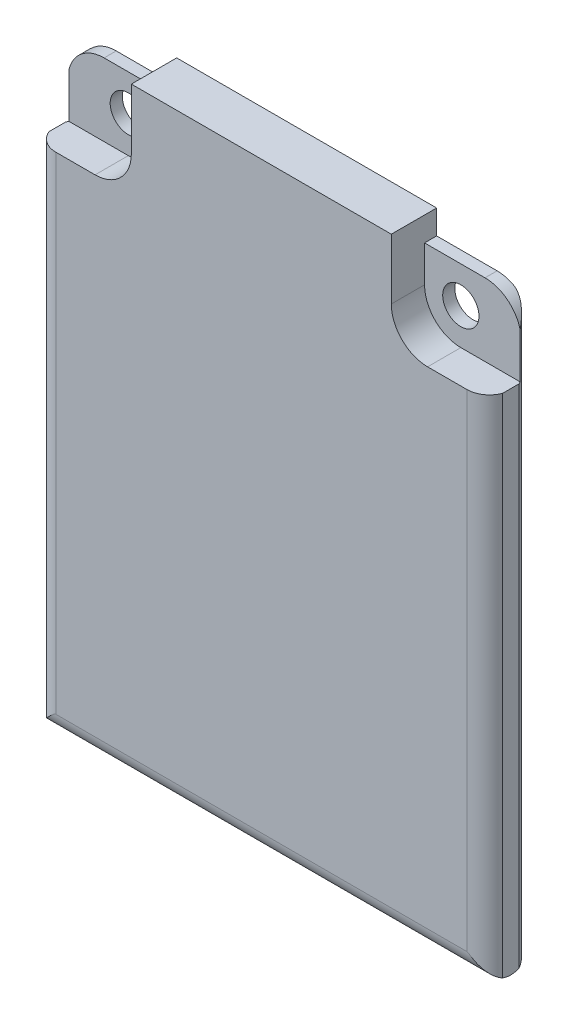
from build123d import *

# Parameters (mm, degrees)
RESSALTO_EXTRUS_O1_DEPTH = 3.75
ESBO_O1_3_R              = 1.5
RESSALTO_EXTRUS_O2_DEPTH = 1
CORTE_EXTRUS_O1_DEPTH    = 46.225131288
CORTE_EXTRUS_O2_DEPTH    = 54.531532763


with BuildPart() as part:
    # Esboço1 → Ressalto-extrusão1 (new body)
    with BuildSketch(Plane.XY):
        with BuildLine():
            Line((10.75, 25), (-10.75, 25))
            Line((-10.75, 25), (-10.75, 23))
            Line((-10.75, 23), (-10.75, 20))
            ThreePointArc((-10.75, 20), (-11.628679656, 17.878679656), (-13.75, 17))
            Line((-13.75, 17), (-18.75, 17))
            Line((-18.75, 17), (-18.75, -25))
            Line((-18.75, -25), (18.75, -25))
            Line((18.75, -25), (18.75, 17))
            Line((18.75, 17), (13.75, 17))
            ThreePointArc((13.75, 17), (11.628679656, 17.878679656), (10.75, 20))
            Line((10.75, 20), (10.75, 23))
            Line((10.75, 23), (10.75, 25))
        make_face()
    extrude(amount=RESSALTO_EXTRUS_O1_DEPTH)

    # Esboço1<3> → Ressalto-extrusão2 (add)
    # profile 1 of 2: a face of its own
    with BuildSketch(Plane.XY):
        with BuildLine():
            Line((-10.75, 20), (-10.75, 23))
            Line((-10.75, 23), (-15.75, 23))
            ThreePointArc((-15.75, 23), (-17.871320344, 22.121320344), (-18.75, 20))
            Line((-18.75, 20), (-18.75, 17))
            Line((-18.75, 17), (-13.75, 17))
            ThreePointArc((-13.75, 17), (-11.628679656, 17.878679656), (-10.75, 20))
        make_face()
        with Locations((-13.75, 20)):
            Circle(ESBO_O1_3_R, mode=Mode.SUBTRACT)
    # profile 2 of 2: a face of its own
    with BuildSketch(Plane.XY):
        with BuildLine():
            Line((15.75, 23), (10.75, 23))
            Line((10.75, 23), (10.75, 20))
            ThreePointArc((10.75, 20), (11.628679656, 17.878679656), (13.75, 17))
            Line((13.75, 17), (18.75, 17))
            Line((18.75, 17), (18.75, 20))
            ThreePointArc((18.75, 20), (17.871320344, 22.121320344), (15.75, 23))
        make_face()
        with Locations((13.75, 20)):
            Circle(ESBO_O1_3_R, mode=Mode.SUBTRACT)
    extrude(amount=RESSALTO_EXTRUS_O2_DEPTH)

    # Esboço3 → Corte-extrusão1 (cut, through all)
    with BuildSketch(Plane.ZY.offset(18.75)):
        with BuildLine():
            ThreePointArc((1.875, -25), (0.595000227, -24.49695337), (0, -23.257021896))
            Line((0, -23.257021896), (0, -25))
            Line((0, -25), (1.875, -25))
        make_face()
        with BuildLine():
            ThreePointArc((3.75, -23.257021896), (3.154999773, -24.49695337), (1.875, -25))
            Line((1.875, -25), (3.75, -25))
            Line((3.75, -25), (3.75, -23.257021896))
        make_face()
    extrude(amount=-CORTE_EXTRUS_O1_DEPTH, mode=Mode.SUBTRACT)

    # Esboço4 → Corte-extrusão2 (cut, through all)
    with BuildSketch(Plane(origin=(0, 25, 0), x_dir=(1, 0, 0), z_dir=(0, 1, 0))):
        with BuildLine():
            Line((17, -4.75), (-17, -4.75))
            ThreePointArc((-17, -4.75), (-19.875, -1.875), (-17, 1))
            Line((-17, 1), (17, 1))
            ThreePointArc((17, 1), (19.875, -1.875), (17, -4.75))
        make_face()
        with BuildLine():
            Line((17, -3.75), (-17, -3.75))
            ThreePointArc((-17, -3.75), (-18.875, -1.875), (-17, 0))
            Line((-17, 0), (17, 0))
            ThreePointArc((17, 0), (18.875, -1.875), (17, -3.75))
        make_face(mode=Mode.SUBTRACT)
    extrude(amount=-CORTE_EXTRUS_O2_DEPTH, mode=Mode.SUBTRACT)


solid = part.part
